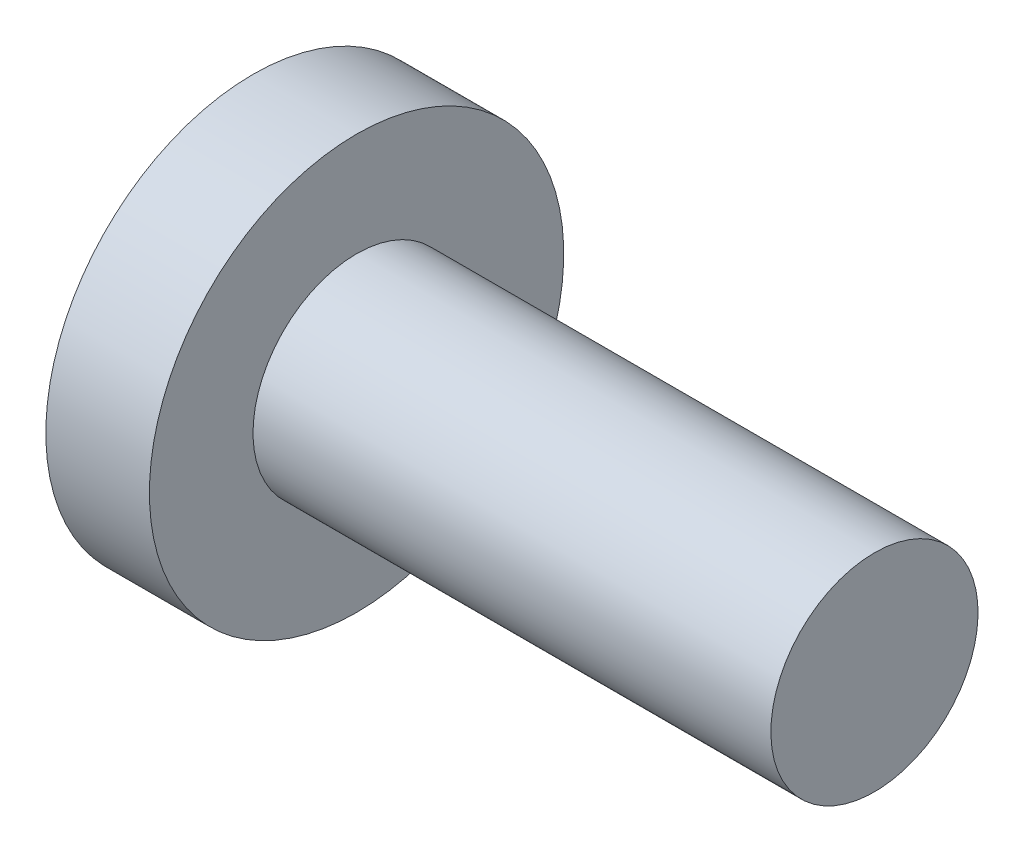
from build123d import *


with BuildPart() as part:
    # Sketch1 → Revolve1 (revolve)
    with BuildSketch(Plane.XY):
        Polygon((0, 0), (1, 0), (1, -1), (6, -1), (6, -2), (0, -2), align=None)
    revolve(axis=Axis((6, -2, 0), (-1, 0, 0)))


solid = part.part
